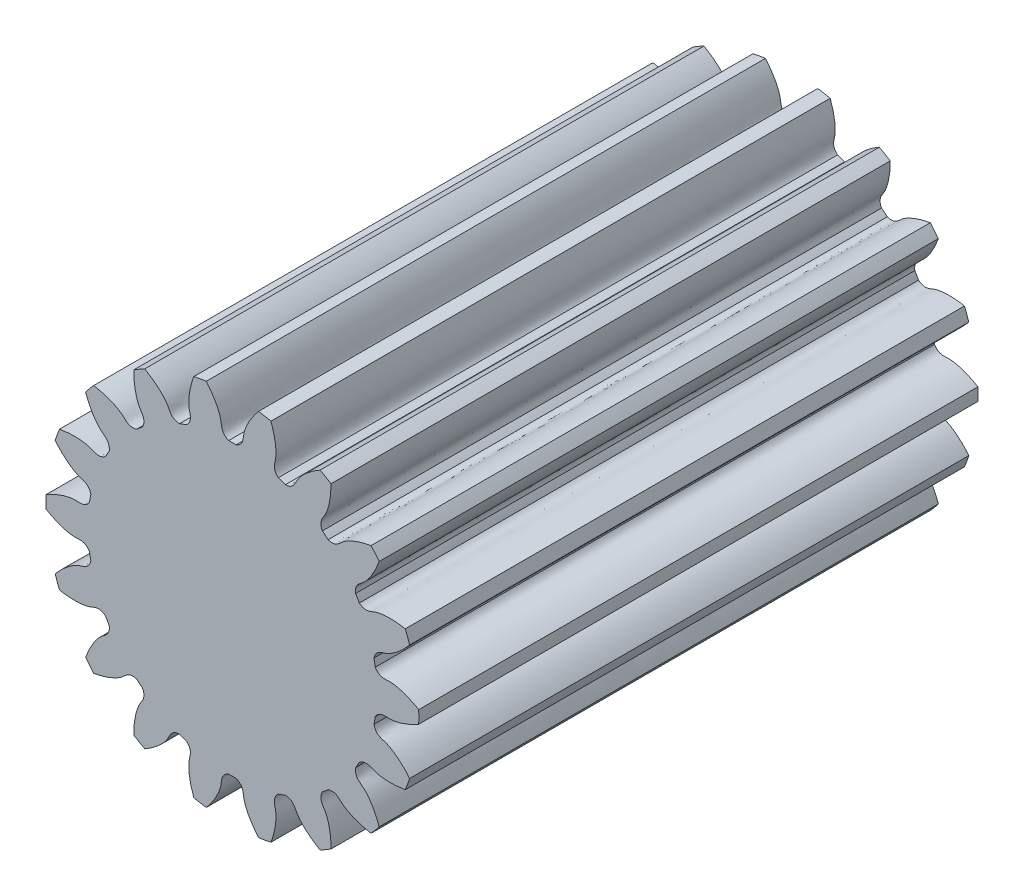
from build123d import *

# Parameters (mm, degrees)
SKETCH_1_R               = 10
EXTRUDE_1_DEPTH          = 30
CUT_EXTRUDE_1_DEPTH      = 34.166247904
PATTERN_CIRCULAR_1_COUNT = 18


with BuildPart() as part:
    # 草图1 → 凸台-拉伸1 (new body)
    with BuildSketch(Plane.XY):
        Circle(SKETCH_1_R)
    extrude(amount=EXTRUDE_1_DEPTH)

    # 草图2 → 切除-拉伸1 (cut, through all)
    with BuildSketch(Plane.XY):
        with BuildLine():
            ThreePointArc((0.199403559, 7.747434299), (0, 7.75), (-0.199403559, 7.747434299))
            add(Edge.make_bspline(
                [(-0.199403559, 7.747434299), (-0.61510404, 7.918680391), (-0.56278905, 8.238699502), (-0.631832915, 8.542595456), (-0.63875152, 8.570506601), (-0.647107593, 8.601540475), (-0.65702471, 8.635650183), (-0.668630031, 8.672784168), (-0.682047718, 8.712887332), (-0.697400853, 8.755900732), (-0.714810717, 8.801761729), (-0.734396875, 8.850403997), (-0.756277026, 8.901757578), (-0.780566921, 8.955748932), (-0.807380259, 9.01230098), (-0.836828597, 9.071333165), (-0.869021256, 9.132761504), (-0.904065225, 9.196498643), (-0.942065076, 9.262453924), (-0.98312287, 9.330533439), (-1.027338072, 9.400640102), (-1.074807462, 9.472673712), (-1.125625055, 9.54653102), (-1.179882014, 9.622105805), (-1.237666571, 9.699288945), (-1.299063947, 9.777968491), (-1.364156275, 9.858029744), (-1.433022524, 9.939355337), (-1.505738425, 10.021825314), (-1.582376404, 10.105317214), (-1.663005502, 10.189706153), (-1.747691321, 10.274864914), (-1.836495946, 10.360664035), (-1.929477891, 10.446971896), (-2.026692033, 10.533654813), (-2.128189554, 10.620577131), (-2.234017887, 10.707601317), (-2.34422066, 10.79458806), (-2.45883764, 10.881396363), (-2.577904698, 10.967883646), (-2.701453724, 11.053905845), (-2.874075353, 11.169039516), (-3.007555439, 11.252333779), (-3.098560891, 11.30667838)],
                knots=[0, 0, 0, 0, 0.187591972, 0.192996016, 0.1991206, 0.205965723, 0.213531386, 0.221817587, 0.230824328, 0.240551609, 0.250999428, 0.262167787, 0.274056685, 0.286666122, 0.299996099, 0.314046614, 0.32881767, 0.344309264, 0.360521397, 0.37745407, 0.395107283, 0.413481034, 0.432575325, 0.452390155, 0.472925524, 0.494181432, 0.51615788, 0.538854867, 0.562272393, 0.586410459, 0.611269064, 0.636848208, 0.663147891, 0.690168114, 0.717908876, 0.746370177, 0.775552017, 0.805454397, 0.836077316, 0.867420774, 0.899484772, 0.932269309, 1, 1, 1, 1], degree=3))
            ThreePointArc((-3.098560891, 11.30667838), (0, 11.723568381), (3.098560891, 11.30667838))
            add(Edge.make_bspline(
                [(0.199403559, 7.747434299), (0.61510404, 7.918680391), (0.56278905, 8.238699502), (0.631832915, 8.542595456), (0.63875152, 8.570506601), (0.647107593, 8.601540475), (0.65702471, 8.635650183), (0.668630031, 8.672784168), (0.682047718, 8.712887332), (0.697400853, 8.755900732), (0.714810717, 8.801761729), (0.734396875, 8.850403997), (0.756277026, 8.901757578), (0.780566921, 8.955748932), (0.807380259, 9.01230098), (0.836828597, 9.071333165), (0.869021256, 9.132761504), (0.904065225, 9.196498643), (0.942065076, 9.262453924), (0.98312287, 9.330533439), (1.027338072, 9.400640102), (1.074807462, 9.472673712), (1.125625055, 9.54653102), (1.179882014, 9.622105805), (1.237666571, 9.699288945), (1.299063947, 9.777968491), (1.364156275, 9.858029744), (1.433022524, 9.939355337), (1.505738425, 10.021825314), (1.582376404, 10.105317214), (1.663005502, 10.189706153), (1.747691321, 10.274864914), (1.836495946, 10.360664035), (1.929477891, 10.446971896), (2.026692033, 10.533654813), (2.128189554, 10.620577131), (2.234017887, 10.707601317), (2.34422066, 10.79458806), (2.45883764, 10.881396363), (2.577904698, 10.967883646), (2.701453724, 11.053905845), (2.874075353, 11.169039516), (3.007555439, 11.252333779), (3.098560891, 11.30667838)],
                knots=[0, 0, 0, 0, 0.187591972, 0.192996016, 0.1991206, 0.205965723, 0.213531386, 0.221817587, 0.230824328, 0.240551609, 0.250999428, 0.262167787, 0.274056685, 0.286666122, 0.299996099, 0.314046614, 0.32881767, 0.344309264, 0.360521397, 0.37745407, 0.395107283, 0.413481034, 0.432575325, 0.452390155, 0.472925524, 0.494181432, 0.51615788, 0.538854867, 0.562272393, 0.586410459, 0.611269064, 0.636848208, 0.663147891, 0.690168114, 0.717908876, 0.746370177, 0.775552017, 0.805454397, 0.836077316, 0.867420774, 0.899484772, 0.932269309, 1, 1, 1, 1], degree=3))
        make_face()
    cut_extrude_1 = extrude(amount=CUT_EXTRUDE_1_DEPTH, mode=Mode.SUBTRACT)

    # 阵列(圆周)1: 切除-拉伸1 ×18 about axis
    pattern_circular_1_axis = Axis((0, 0, -1.5), (0, 0, 1))
    for i in range(1, PATTERN_CIRCULAR_1_COUNT):
        add(cut_extrude_1.rotate(pattern_circular_1_axis, i * 360 / PATTERN_CIRCULAR_1_COUNT), mode=Mode.SUBTRACT)


solid = part.part
